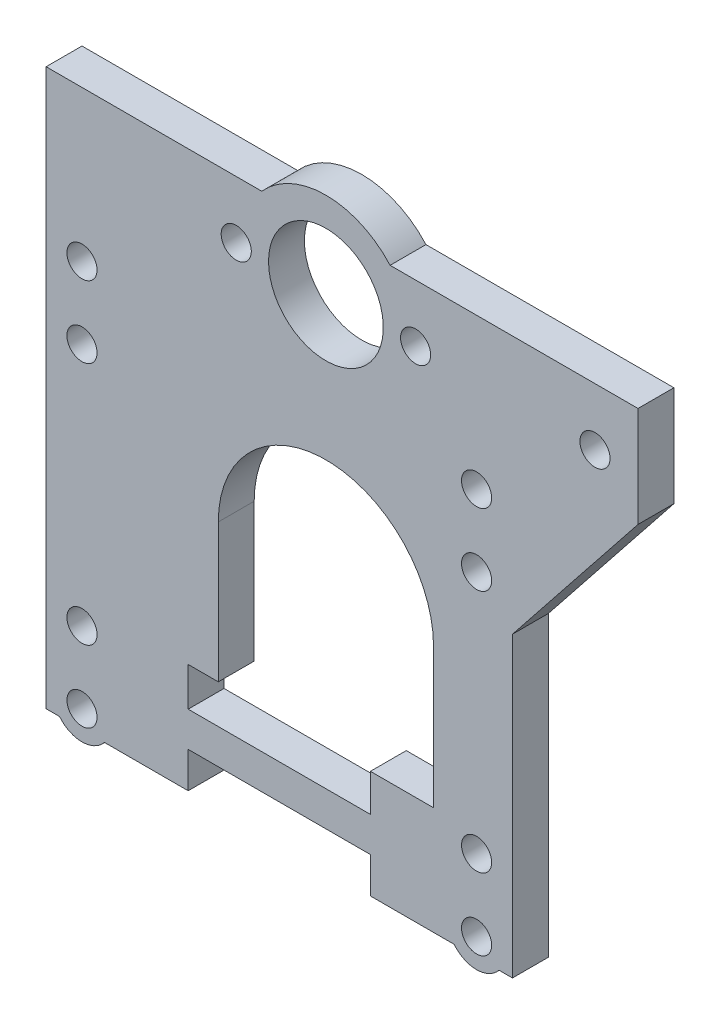
from build123d import *

# Parameters (mm, degrees)
SKETCH1_R           = 2.1
SKETCH1_W           = 25
SKETCH1_H           = 5.1
BOSS_EXTRUDE1_DEPTH = 5
CUT_EXTRUDE2_DEPTH  = 5
SKETCH4_R           = 2.1
SKETCH4_R_2         = 4
BOSS_EXTRUDE2_DEPTH = 5
SKETCH5_W           = 25.4
SKETCH5_H           = 5
SKETCH5_H_2         = 5.4
CUT_EXTRUDE3_DEPTH  = 10
BOSS_EXTRUDE3_DEPTH = 5
SKETCH7_R           = 8
CUT_EXTRUDE6_DEPTH  = 5


with BuildPart() as part:
    # Sketch1 → Boss-Extrude1 (new body)
    with BuildSketch(Plane.XY):
        with BuildLine():
            Line((-65, 61.5), (0, 61.5))
            Line((0, 61.5), (0, 0))
            Line((0, 0), (-1.877501001, 0))
            ThreePointArc((-1.877501001, 0), (-5, -1.5), (-8.122498999, 0))
            Line((-8.122498999, 0), (-20, 0))
            Line((-20, 0), (-20, 5))
            Line((-20, 5), (-45, 5))
            Line((-45, 5), (-45, 0))
            Line((-45, 0), (-56.877501001, 0))
            ThreePointArc((-56.877501001, 0), (-60, -1.5), (-63.122498999, 0))
            Line((-63.122498999, 0), (-65, 0))
            Line((-65, 0), (-65, 61.5))
        make_face()
        with Locations((-60, 56.5)):
            Circle(SKETCH1_R, mode=Mode.SUBTRACT)
        with Locations((-5, 56.5)):
            Circle(SKETCH1_R, mode=Mode.SUBTRACT)
        with Locations((-60, 46.5)):
            Circle(SKETCH1_R, mode=Mode.SUBTRACT)
        with Locations((-5, 46.5)):
            Circle(SKETCH1_R, mode=Mode.SUBTRACT)
        with Locations(Location((-5, 12.5, 0), (0, 0, 180))):
            Circle(SKETCH1_R, mode=Mode.SUBTRACT)
        with Locations(Location((-5, 2.5, 0), (0, 0, 180))):
            Circle(SKETCH1_R, mode=Mode.SUBTRACT)
        with Locations(Location((-60, 2.5, 0), (0, 0, 180))):
            Circle(SKETCH1_R, mode=Mode.SUBTRACT)
        with Locations(Location((-60, 12.5, 0), (0, 0, 180))):
            Circle(SKETCH1_R, mode=Mode.SUBTRACT)
        with Locations((-32.5, 12.5)):
            Rectangle(SKETCH1_W, SKETCH1_H, mode=Mode.SUBTRACT)
    extrude(amount=BOSS_EXTRUDE1_DEPTH)

    # Sketch3 → Cut-Extrude2 (cut)
    with BuildSketch(Plane(origin=(0, 0, 0), x_dir=(-1, 0, 0), z_dir=(0, 0, -1))):
        with BuildLine():
            Line((41, 15.05), (41, 34.55))
            ThreePointArc((41, 34.55), (26, 49.55), (11, 34.55))
            Line((11, 34.55), (11, 15.05))
            Line((11, 15.05), (41, 15.05))
        make_face()
    extrude(amount=-CUT_EXTRUDE2_DEPTH, mode=Mode.SUBTRACT)

    # Sketch4 → Boss-Extrude2 (add)
    with BuildSketch(Plane(origin=(0, 0, 0), x_dir=(-1, 0, 0), z_dir=(0, 0, -1))):
        Polygon((0, 41.5), (-17.5, 63.5), (-17.5, 77.5), (65, 77.5), (65, 61.5), (0, 61.5), align=None)
        with Locations((-11.5, 69.5)):
            Circle(SKETCH4_R, mode=Mode.SUBTRACT)
        with Locations((13.5, 69.5)):
            Circle(SKETCH4_R, mode=Mode.SUBTRACT)
        with Locations((26, 69.5)):
            Circle(SKETCH4_R_2, mode=Mode.SUBTRACT)
        with Locations((38.5, 69.5)):
            Circle(SKETCH4_R, mode=Mode.SUBTRACT)
    extrude(amount=-BOSS_EXTRUDE2_DEPTH)

    # Sketch5 → Cut-Extrude3 (cut)
    with BuildSketch(Plane(origin=(0, 0, 0), x_dir=(-1, 0, 0), z_dir=(0, 0, -1))):
        with Locations((32.5, 2.5)):
            Rectangle(SKETCH5_W, SKETCH5_H)
        with Locations((32.5, 12.55)):
            Rectangle(SKETCH5_W, SKETCH5_H_2)
    extrude(amount=-CUT_EXTRUDE3_DEPTH, mode=Mode.SUBTRACT)

    # Sketch6 → Boss-Extrude3 (add)
    with BuildSketch(Plane(origin=(0, 0, 0), x_dir=(-1, 0, 0), z_dir=(0, 0, -1))):
        with BuildLine():
            Line((17.05572809, 77.5), (34.94427191, 77.5))
            ThreePointArc((34.94427191, 77.5), (26, 81.5), (17.05572809, 77.5))
        make_face()
    extrude(amount=-BOSS_EXTRUDE3_DEPTH)

    # Sketch7 → Cut-Extrude6 (cut)
    with BuildSketch(Plane(origin=(0, 0, 0), x_dir=(-1, 0, 0), z_dir=(0, 0, -1))):
        with Locations((26, 69.5)):
            Circle(SKETCH7_R)
    extrude(amount=-CUT_EXTRUDE6_DEPTH, mode=Mode.SUBTRACT)


solid = part.part
